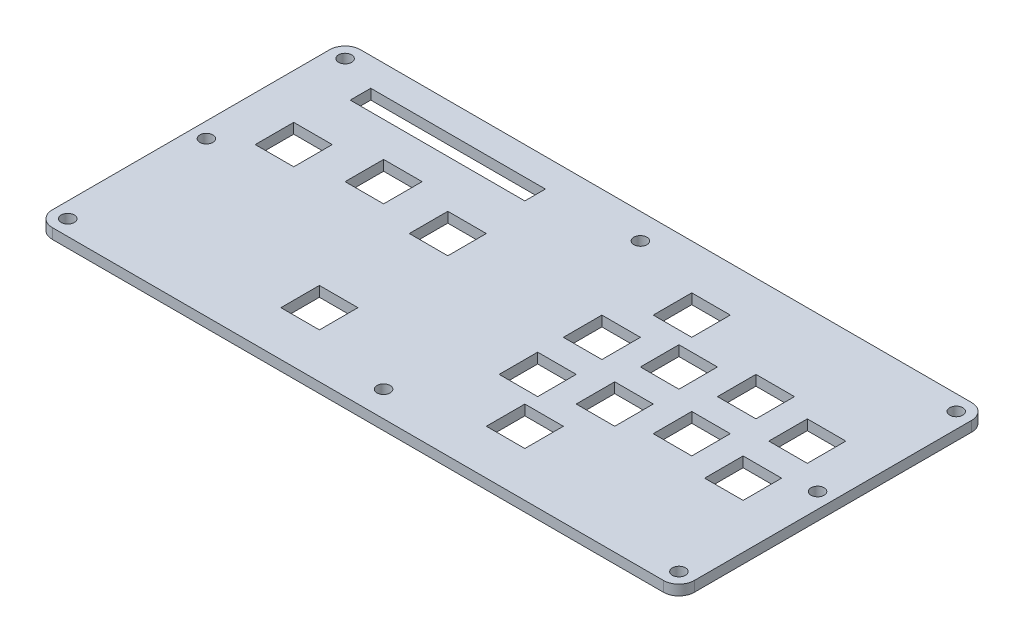
from build123d import *

# Parameters (mm, degrees)
SKETCH_1_R      = 2.55
SKETCH_1_W      = 15
SKETCH_1_H      = 15
SKETCH_1_W_2    = 68
SKETCH_1_H_2    = 8
EXTRUDE_1_DEPTH = 4


with BuildPart() as part:
    # 草图1 → 凸台-拉伸1 (new body)
    with BuildSketch(Plane(origin=(0, 0, 0), x_dir=(1, 0, 0), z_dir=(0, 1, 0))):
        with BuildLine():
            Line((2958.153435269, 1776.763982112), (3196.153435269, 1776.763982112))
            ThreePointArc((3196.153435269, 1776.763982112), (3200.396075956, 1775.006622799), (3202.153435269, 1770.763982112))
            Line((3202.153435269, 1770.763982112), (3202.153435269, 1662.763982112))
            ThreePointArc((3202.153435269, 1662.763982112), (3200.396075956, 1658.521341424), (3196.153435269, 1656.763982112))
            Line((3196.153435269, 1656.763982112), (2958.153435269, 1656.763982112))
            ThreePointArc((2958.153435269, 1656.763982112), (2953.910794582, 1658.521341424), (2952.153435269, 1662.763982112))
            Line((2952.153435269, 1662.763982112), (2952.153435269, 1770.763982112))
            ThreePointArc((2952.153435269, 1770.763982112), (2953.910794582, 1775.006622799), (2958.153435269, 1776.763982112))
        make_face()
        with Locations(Location((2958.153435269, 1770.763982112, 0), (0, 0, 270))):
            Circle(SKETCH_1_R, mode=Mode.SUBTRACT)
        with Locations(Location((3196.153435269, 1770.763982112, 0), (0, 0, 270))):
            Circle(SKETCH_1_R, mode=Mode.SUBTRACT)
        with Locations(Location((3077.153435269, 1766.763982112, 0), (0, 0, 270))):
            Circle(SKETCH_1_R, mode=Mode.SUBTRACT)
        with Locations(Location((2958.153435269, 1662.763982112, 0), (0, 0, 270))):
            Circle(SKETCH_1_R, mode=Mode.SUBTRACT)
        with Locations(Location((3196.153435269, 1662.763982112, 0), (0, 0, 270))):
            Circle(SKETCH_1_R, mode=Mode.SUBTRACT)
        with Locations(Location((3077.153435269, 1666.763982112, 0), (0, 0, 270))):
            Circle(SKETCH_1_R, mode=Mode.SUBTRACT)
        with Locations(Location((3196.153435269, 1716.763982112, 0), (0, 0, 270))):
            Circle(SKETCH_1_R, mode=Mode.SUBTRACT)
        with Locations(Location((2958.153435269, 1716.763982112, 0), (0, 0, 270))):
            Circle(SKETCH_1_R, mode=Mode.SUBTRACT)
        with Locations((2977.153435269, 1731.763982112)):
            Rectangle(SKETCH_1_W, SKETCH_1_H, mode=Mode.SUBTRACT)
        with Locations((3007.153435269, 1736.763982112)):
            Rectangle(SKETCH_1_W, SKETCH_1_H, mode=Mode.SUBTRACT)
        with Locations((3102.153435269, 1726.763982112)):
            Rectangle(SKETCH_1_W, SKETCH_1_H, mode=Mode.SUBTRACT)
        with Locations((3037.153435269, 1681.763982112)):
            Rectangle(SKETCH_1_W, SKETCH_1_H, mode=Mode.SUBTRACT)
        with Locations((3037.153435269, 1731.763982112)):
            Rectangle(SKETCH_1_W, SKETCH_1_H, mode=Mode.SUBTRACT)
        with Locations((3112.153435269, 1751.763982112)):
            Rectangle(SKETCH_1_W, SKETCH_1_H, mode=Mode.SUBTRACT)
        with Locations((3127.153435269, 1731.763982112)):
            Rectangle(SKETCH_1_W, SKETCH_1_H, mode=Mode.SUBTRACT)
        with Locations((3152.153435269, 1736.763982112)):
            Rectangle(SKETCH_1_W, SKETCH_1_H, mode=Mode.SUBTRACT)
        with Locations((3127.153435269, 1706.763982112)):
            Rectangle(SKETCH_1_W, SKETCH_1_H, mode=Mode.SUBTRACT)
        with Locations((3177.153435269, 1706.763982112)):
            Rectangle(SKETCH_1_W, SKETCH_1_H, mode=Mode.SUBTRACT)
        with Locations((3152.153435269, 1711.763982112)):
            Rectangle(SKETCH_1_W, SKETCH_1_H, mode=Mode.SUBTRACT)
        with Locations((3102.153435269, 1701.763982112)):
            Rectangle(SKETCH_1_W, SKETCH_1_H, mode=Mode.SUBTRACT)
        with Locations((3117.153435269, 1681.763982112)):
            Rectangle(SKETCH_1_W, SKETCH_1_H, mode=Mode.SUBTRACT)
        with Locations((3177.153435269, 1731.763982112)):
            Rectangle(SKETCH_1_W, SKETCH_1_H, mode=Mode.SUBTRACT)
        with Locations((3007.153435269, 1761.763982112)):
            Rectangle(SKETCH_1_W_2, SKETCH_1_H_2, mode=Mode.SUBTRACT)
    extrude(amount=EXTRUDE_1_DEPTH)


solid = part.part
